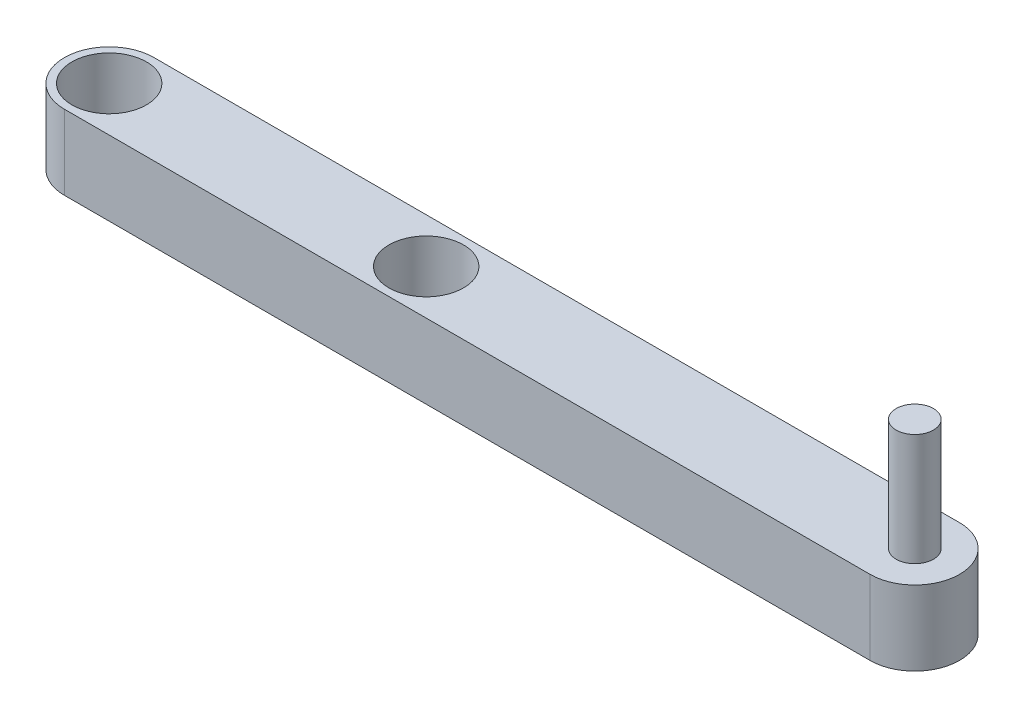
from build123d import *

# Parameters (mm, degrees)
SKETCH1_R           = 5
BOSS_EXTRUDE1_DEPTH = 10
SKETCH2_R           = 2.5
BOSS_EXTRUDE2_DEPTH = 15


with BuildPart() as part:
    # Sketch1 → Boss-Extrude1 (new body)
    with BuildSketch(Plane(origin=(0, 0, 0), x_dir=(1, 0, 0), z_dir=(0, 1, 0))):
        with BuildLine():
            Line((0, 6), (108, 6))
            ThreePointArc((108, 6), (114, 0), (108, -6))
            Line((108, -6), (0, -6))
            ThreePointArc((0, -6), (-6, 0), (0, 6))
        make_face()
        with Locations(Location((0, 0, 0), (0, 0, 270))):
            Circle(SKETCH1_R, mode=Mode.SUBTRACT)
        with Locations(Location((42.5, 0, 0), (0, 0, 270))):
            Circle(SKETCH1_R, mode=Mode.SUBTRACT)
    extrude(amount=BOSS_EXTRUDE1_DEPTH)

    # Sketch2 → Boss-Extrude2 (add)
    with BuildSketch(Plane(origin=(0, 10, 0), x_dir=(1, 0, 0), z_dir=(0, 1, 0))):
        with Locations(Location((108, 0, 0), (0, 0, 270))):
            Circle(SKETCH2_R)
    extrude(amount=BOSS_EXTRUDE2_DEPTH)


solid = part.part
